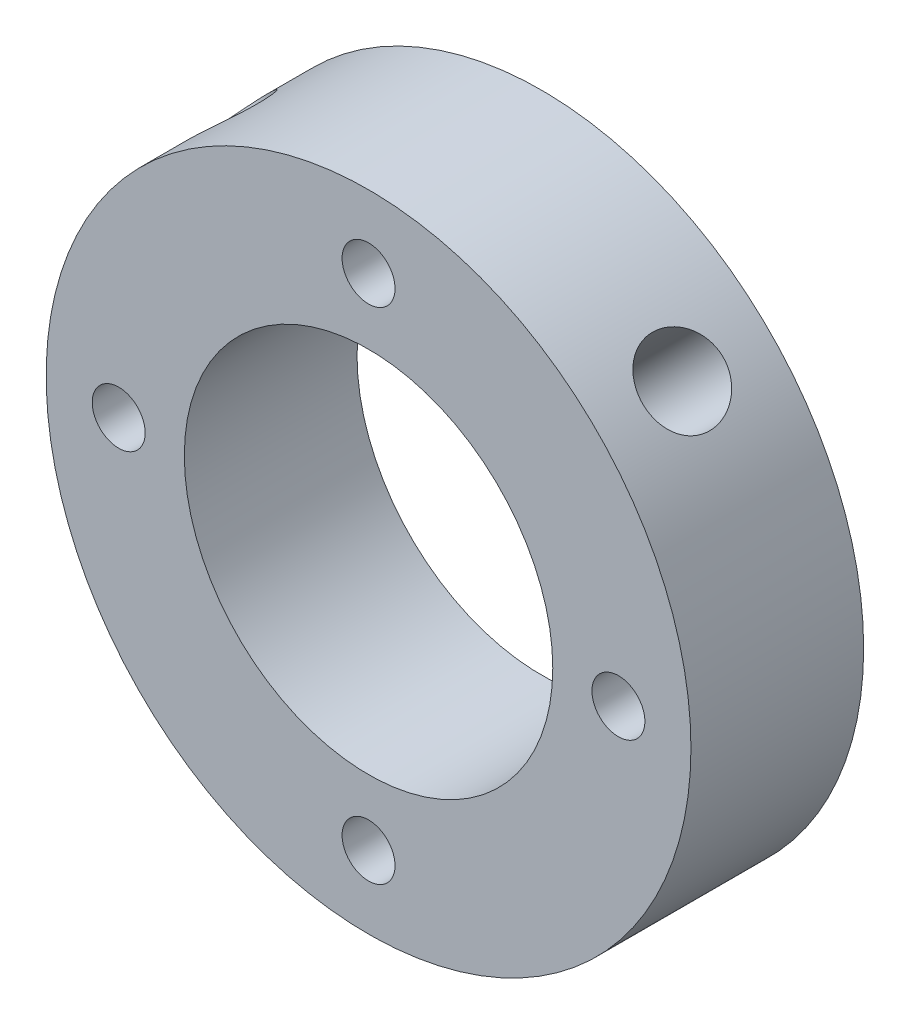
from build123d import *

# Parameters (mm, degrees)
SKETCH2_R           = 14
SKETCH2_R_2         = 8
BOSS_EXTRUDE2_DEPTH = 7.5
SKETCH5_R           = 1.15
CUT_EXTRUDE2_DEPTH  = 22.17191536
SKETCH7_R           = 1.75
CUT_EXTRUDE3_DEPTH  = 7
SKETCH9_R           = 1.75
CUT_EXTRUDE4_DEPTH  = 7


with BuildPart() as part:
    # Sketch2 → Boss-Extrude2 (new body)
    with BuildSketch(Plane.XY.offset(2)):
        Circle(SKETCH2_R)
        Circle(SKETCH2_R_2, mode=Mode.SUBTRACT)
    extrude(amount=BOSS_EXTRUDE2_DEPTH)

    # Sketch5 → Cut-Extrude2 (cut, through all)
    with BuildSketch(Plane.XY.offset(9.5)):
        with Locations((0, 10.85)):
            Circle(SKETCH5_R)
        with Locations((10.85, 0)):
            Circle(SKETCH5_R)
        with Locations((0, -10.85)):
            Circle(SKETCH5_R)
        with Locations((-10.85, 0)):
            Circle(SKETCH5_R)
    extrude(amount=-CUT_EXTRUDE2_DEPTH, mode=Mode.SUBTRACT)

    # Sketch7 → Cut-Extrude3 (cut)
    with BuildSketch(Plane(origin=(9.899494937, 9.899494937, 0), x_dir=(0.7071067811865489, -0.7071067811865461, 0), z_dir=(0.7071067811865461, 0.7071067811865489, 0))):
        with Locations((0, -5.75)):
            Circle(SKETCH7_R)
    extrude(amount=-CUT_EXTRUDE3_DEPTH, mode=Mode.SUBTRACT)

    # Sketch9 → Cut-Extrude4 (cut)
    with BuildSketch(Plane(origin=(-9.899494937, 9.899494937, 0), x_dir=(0, 0, 1), z_dir=(-0.7071067811865489, 0.7071067811865462, 0))):
        with Locations((5.75, 0)):
            Circle(SKETCH9_R)
    extrude(amount=-CUT_EXTRUDE4_DEPTH, mode=Mode.SUBTRACT)


solid = part.part
